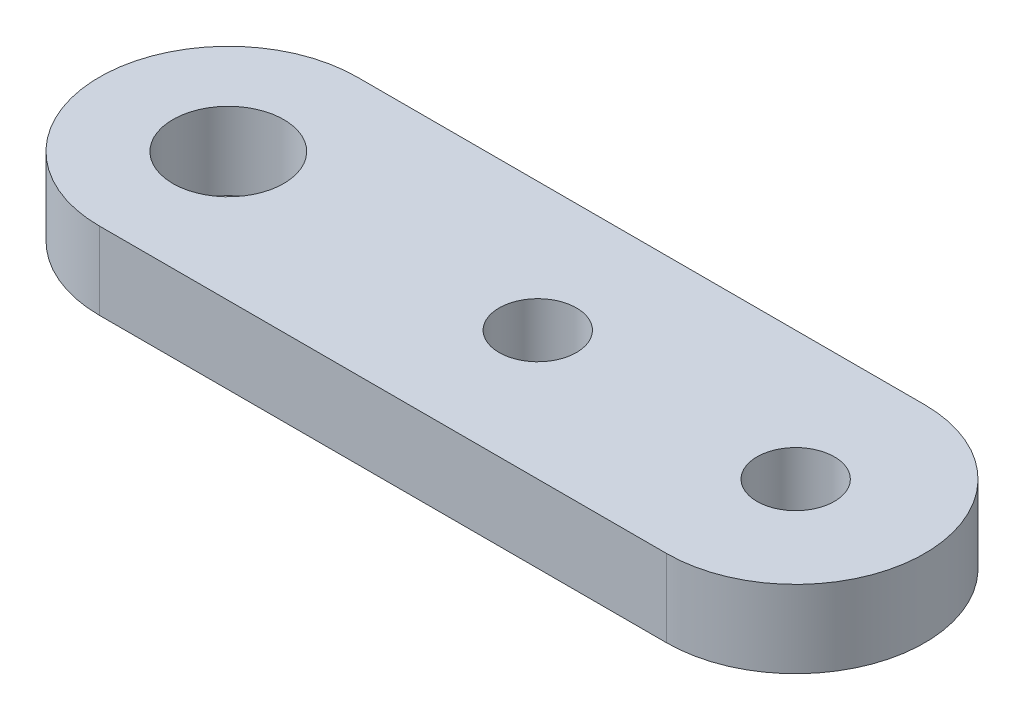
from build123d import *

# Parameters (mm, degrees)
SKETCH_1_R      = 1.5
SKETCH_1_R_2    = 2.15
EXTRUDE_1_DEPTH = 3


with BuildPart() as part:
    # 草图1 → 凸台-拉伸1 (new body)
    with BuildSketch(Plane(origin=(0, 0, 0), x_dir=(1, 0, 0), z_dir=(0, 1, 0))):
        with BuildLine():
            Line((-22, 5), (0, 5))
            ThreePointArc((0, 5), (5, 0), (0, -5))
            Line((0, -5), (-22, -5))
            ThreePointArc((-22, -5), (-27, 0), (-22, 5))
        make_face()
        with Locations(Location((0, 0, 0), (0, 0, 270))):
            Circle(SKETCH_1_R, mode=Mode.SUBTRACT)
        with Locations(Location((-10, 0, 0), (0, 0, 270))):
            Circle(SKETCH_1_R, mode=Mode.SUBTRACT)
        with Locations(Location((-22, 0, 0), (0, 0, 270))):
            Circle(SKETCH_1_R_2, mode=Mode.SUBTRACT)
    extrude(amount=EXTRUDE_1_DEPTH)


solid = part.part
